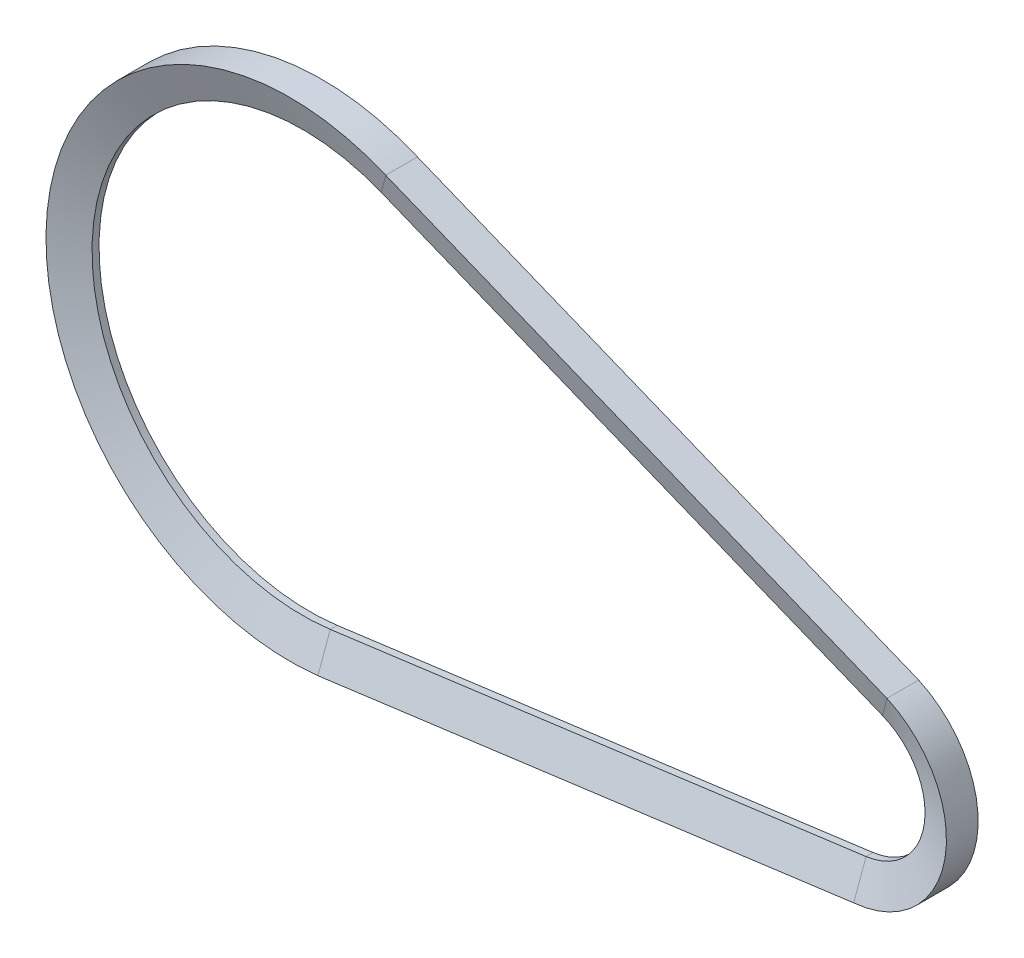
from build123d import *


with BuildPart() as part:
    # Sweep1: sweep along a path in Sketch1
    with BuildLine(Plane.XY) as sweep1_path:
        Line((17.412721367, 43.116668872), (128.117006893, -1.591397138))
        ThreePointArc((128.117006893, -1.591397138), (137.381347861, -17.382946056), (124.475719307, -30.369315156))
        Line((124.475719307, -30.369315156), (6.124729851, -46.094876985))
        ThreePointArc((6.124729851, -46.094876985), (-46.132178368, 5.837132773), (17.412721367, 43.116668872))
    # Sketch4 → Sweep1 (sweep)
    with BuildSketch(Plane.ZY.offset(-6.124729851)):
        Polygon((-0.770223243, -46.094876985), (0.770223243, -46.094876985), (3.5, -53.594876985), (-3.5, -53.594876985), align=None)
    sweep(path=sweep1_path.line)


solid = part.part
